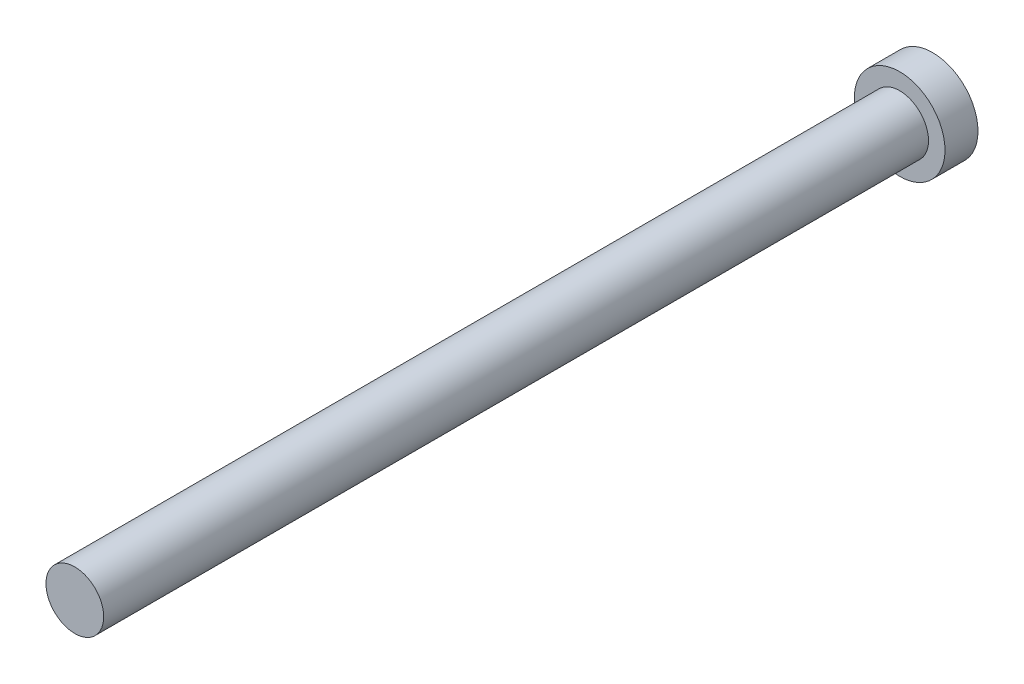
from build123d import *

# Parameters (mm, degrees)
SKETCH_1_R      = 2.75
EXTRUDE_1_DEPTH = 2
SKETCH_2_R      = 1.75
EXTRUDE_2_DEPTH = 50


with BuildPart() as part:
    # 草圖1 → 伸長1 (new body)
    with BuildSketch(Plane.XY):
        Circle(SKETCH_1_R)
    extrude(amount=EXTRUDE_1_DEPTH)

    # 草圖2 → 伸長2 (add)
    with BuildSketch(Plane.XY.offset(2)):
        Circle(SKETCH_2_R)
    extrude(amount=EXTRUDE_2_DEPTH)


solid = part.part
